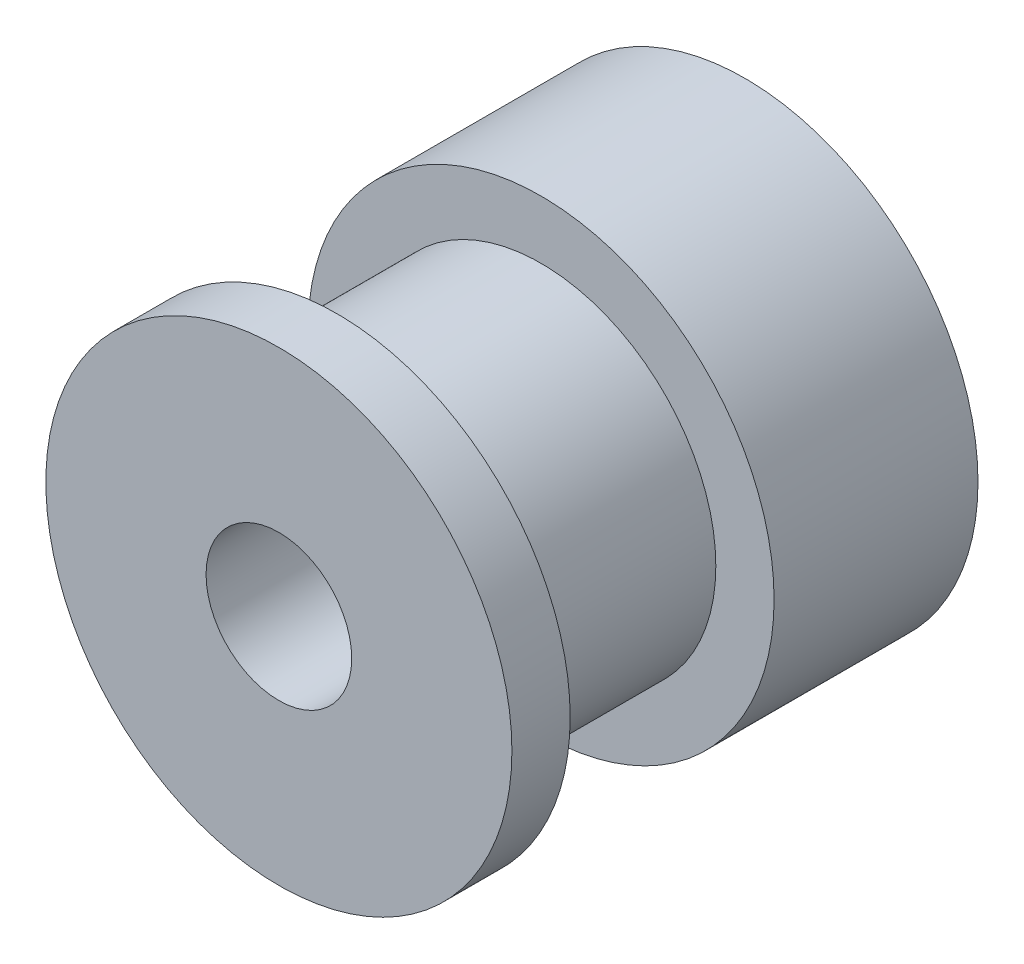
from build123d import *

# Parameters (mm, degrees)
SKETCH_1_R          = 8
EXTRUDE_1_DEPTH     = 7
SKETCH_2_R          = 6
EXTRUDE_2_DEPTH     = 7
SKETCH_3_R          = 8
EXTRUDE_3_DEPTH     = 2
SKETCH_4_R          = 2.5
CUT_EXTRUDE_1_DEPTH = 16


with BuildPart() as part:
    # 草图1 → 凸台-拉伸1 (new body)
    with BuildSketch(Plane.XY):
        Circle(SKETCH_1_R)
    extrude(amount=EXTRUDE_1_DEPTH)

    # 草图2 → 凸台-拉伸2 (add)
    with BuildSketch(Plane.XY.offset(7)):
        Circle(SKETCH_2_R)
    extrude(amount=EXTRUDE_2_DEPTH)

    # 草图3 → 凸台-拉伸3 (add)
    with BuildSketch(Plane.XY.offset(14)):
        Circle(SKETCH_3_R)
    extrude(amount=EXTRUDE_3_DEPTH)

    # 草图4 → 切除-拉伸1 (cut)
    with BuildSketch(Plane(origin=(0, 0, 0), x_dir=(-1, 0, 0), z_dir=(0, 0, -1))):
        Circle(SKETCH_4_R)
    extrude(amount=-CUT_EXTRUDE_1_DEPTH, mode=Mode.SUBTRACT)


solid = part.part
